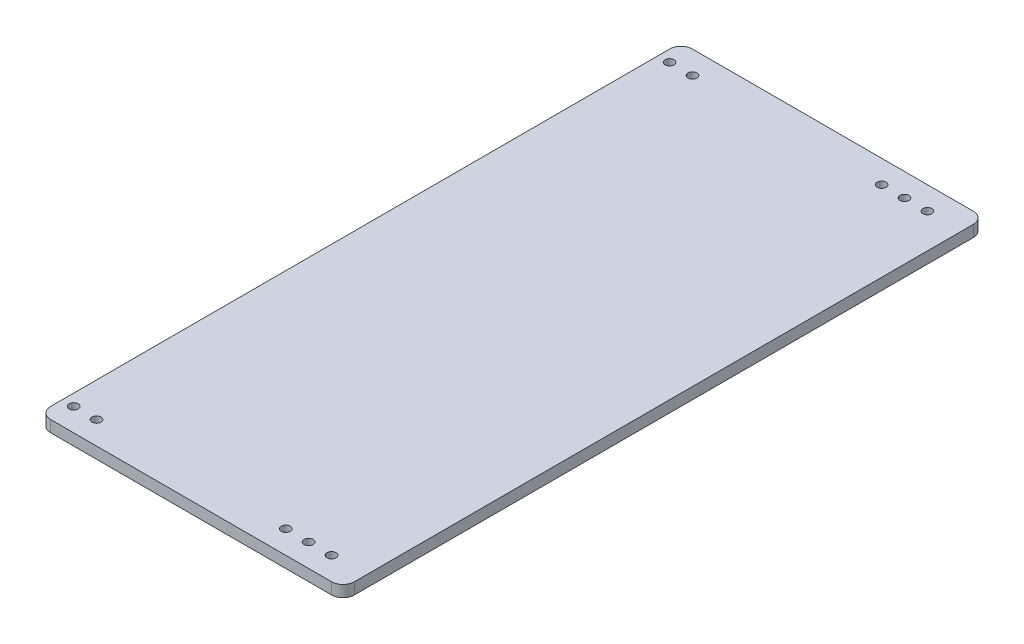
from build123d import *

# Parameters (mm, degrees)
SKETCH1_W           = 168.275
SKETCH1_H           = 355.6
BOSS_EXTRUDE1_DEPTH = 6.35
SKETCH2_R           = 2.4892
CUT_EXTRUDE2_DEPTH  = 197.805186431
FILLET1_R           = 6.35


with BuildPart() as part:
    # Sketch1 → Boss-Extrude1 (new body)
    with BuildSketch(Plane(origin=(0, 0, 0), x_dir=(1, 0, 0), z_dir=(0, 1, 0))):
        Rectangle(SKETCH1_W, SKETCH1_H)
    extrude(amount=BOSS_EXTRUDE1_DEPTH)

    # Sketch2 → Cut-Extrude2 (cut, through all)
    with BuildSketch(Plane(origin=(0, 6.35, 0), x_dir=(1, 0, 0), z_dir=(0, 1, 0))):
        with Locations(Location((65.0875, -165.1, 0), (0, 0, 270))):
            Circle(SKETCH2_R)
        with Locations(Location((52.3875, -165.1, 0), (0, 0, 270))):
            Circle(SKETCH2_R)
        with Locations(Location((39.6875, -165.1, 0), (0, 0, 270))):
            Circle(SKETCH2_R)
        with Locations(Location((65.0875, 165.1, 0), (0, 0, 270))):
            Circle(SKETCH2_R)
        with Locations(Location((52.3875, 165.1, 0), (0, 0, 270))):
            Circle(SKETCH2_R)
        with Locations(Location((39.6875, 165.1, 0), (0, 0, 270))):
            Circle(SKETCH2_R)
        with Locations(Location((-77.7875, -165.1, 0), (0, 0, 270))):
            Circle(SKETCH2_R)
        with Locations(Location((-65.0875, -165.1, 0), (0, 0, 270))):
            Circle(SKETCH2_R)
        with Locations(Location((-77.7875, 165.1, 0), (0, 0, 270))):
            Circle(SKETCH2_R)
        with Locations(Location((-65.0875, 165.1, 0), (0, 0, 270))):
            Circle(SKETCH2_R)
    extrude(amount=-CUT_EXTRUDE2_DEPTH, mode=Mode.SUBTRACT)

    # Fillet1
    fillet1_edges = [part.edges().sort_by_distance(p)[0] for p in [
        (84.1375, 3.175, 177.8),
        (-84.1375, 3.175, 177.8),
        (-84.1375, 3.175, -177.8),
        (84.1375, 3.175, -177.8),
    ]]
    fillet(fillet1_edges, radius=FILLET1_R)


solid = part.part
